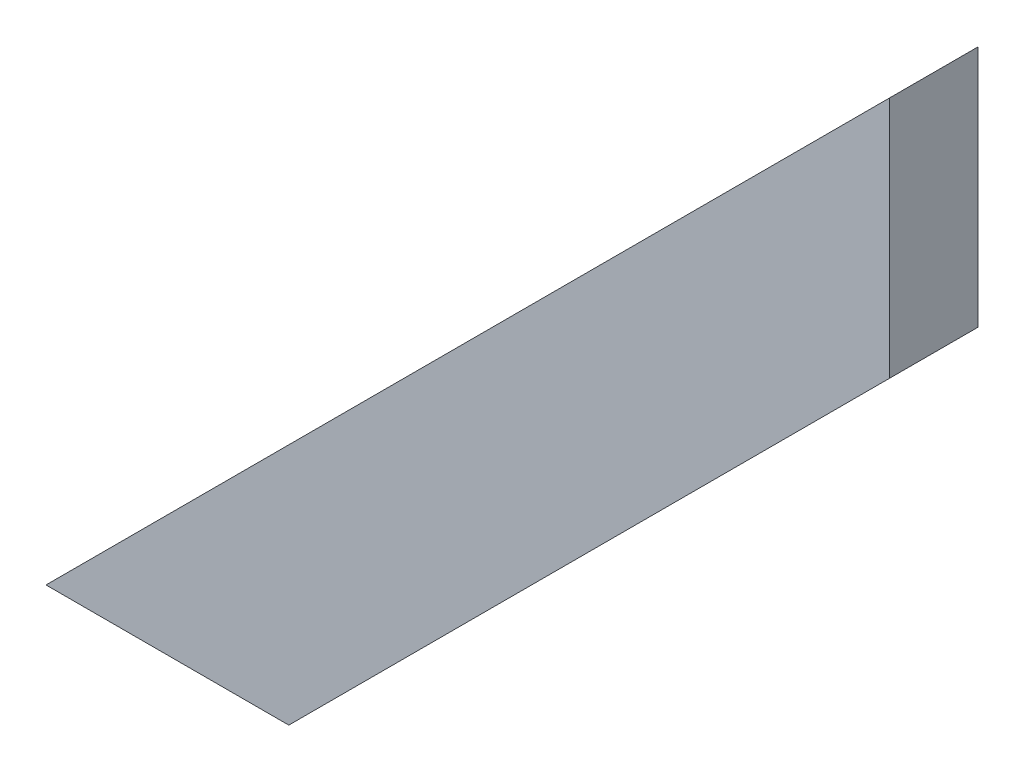
from build123d import *

# Parameters (mm, degrees)
BOSS_EXTRUDE2_DEPTH = 18


with BuildPart() as part:
    # Sketch1 → Boss-Extrude2 (new body)
    with BuildSketch(Plane.XY):
        Polygon((0, 0), (172, 172), (172, 122.502525317), (49.497474683, 0), align=None)
    extrude(amount=BOSS_EXTRUDE2_DEPTH)


solid = part.part
